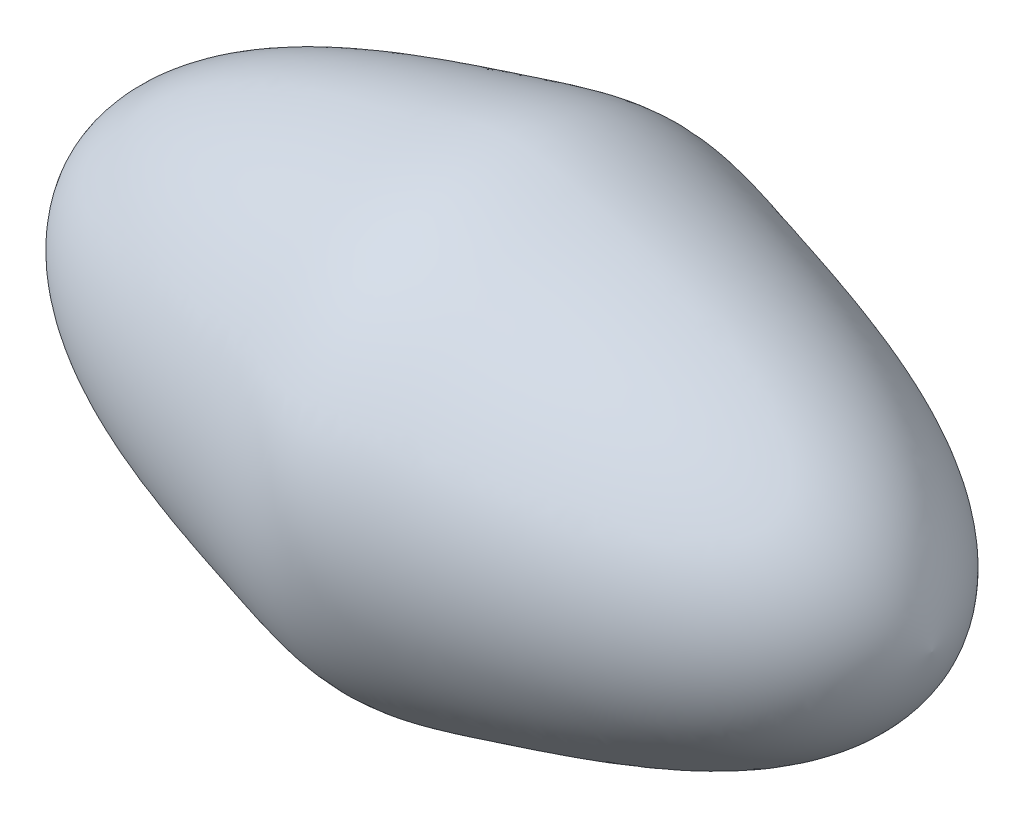
from build123d import *


with BuildPart() as part:
    # 草图2 → 旋转1 (revolve)
    with BuildSketch(Plane.XY):
        with BuildLine():
            add(Edge.make_bspline(
                [(0, 0), (0.224699683, 1.462487126), (2.472505542, 2.035216897), (4.176886689, 2.5), (4.5, 2.5)],
                knots=[0, 0, 0, 0, 0.405210958, 0.5, 0.5, 0.5, 0.5], degree=3))
            Line((0, 0), (4.5, 0))
            Line((4.5, 0), (4.5, 2.5))
        make_face()
        with BuildLine():
            Line((4.5, 2.5), (4.5, 0))
            Line((4.5, 0), (9, 0))
            add(Edge.make_bspline(
                [(4.5, 2.5), (4.823113311, 2.5), (6.527494458, 2.035216897), (8.775300317, 1.462487126), (9, 0)],
                knots=[0.5, 0.5, 0.5, 0.5, 0.594789042, 1, 1, 1, 1], degree=3))
        make_face()
    revolve(axis=Axis((0, 0, 0), (1, 0, 0)))


solid = part.part
